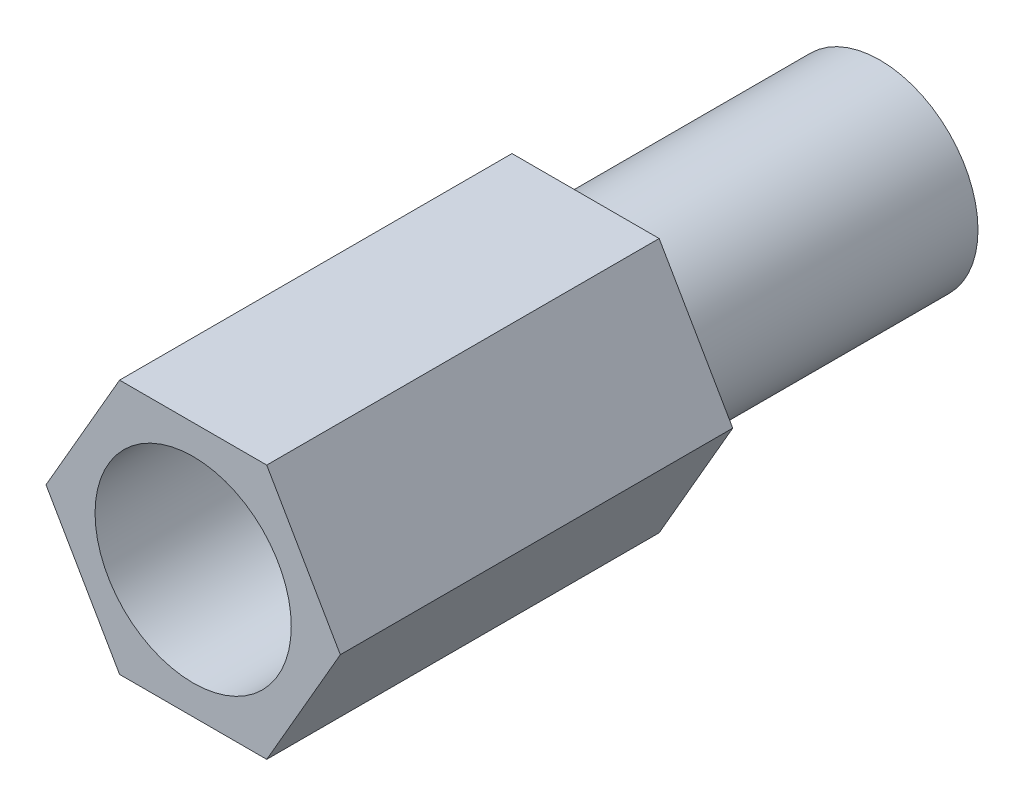
from build123d import *

# Parameters (mm, degrees)
SKETCH_1_R      = 1
EXTRUDE_1_DEPTH = 4
SKETCH_2_R      = 1
EXTRUDE_2_DEPTH = 3


with BuildPart() as part:
    # 草图1 → 凸台-拉伸1 (new body)
    with BuildSketch(Plane.XY):
        Polygon((-1.5, 0), (-0.75, -1.299038106), (0.75, -1.299038106), (1.5, 0), (0.75, 1.299038106), (-0.75, 1.299038106), align=None)
        Circle(SKETCH_1_R, mode=Mode.SUBTRACT)
    extrude(amount=EXTRUDE_1_DEPTH)


with BuildPart() as body_2:
    # 草图2 → 凸台-拉伸2 (new body)
    with BuildSketch(Plane.XY):
        Circle(SKETCH_2_R)
    extrude(amount=-EXTRUDE_2_DEPTH)


solid = Compound([part.part, body_2.part])
